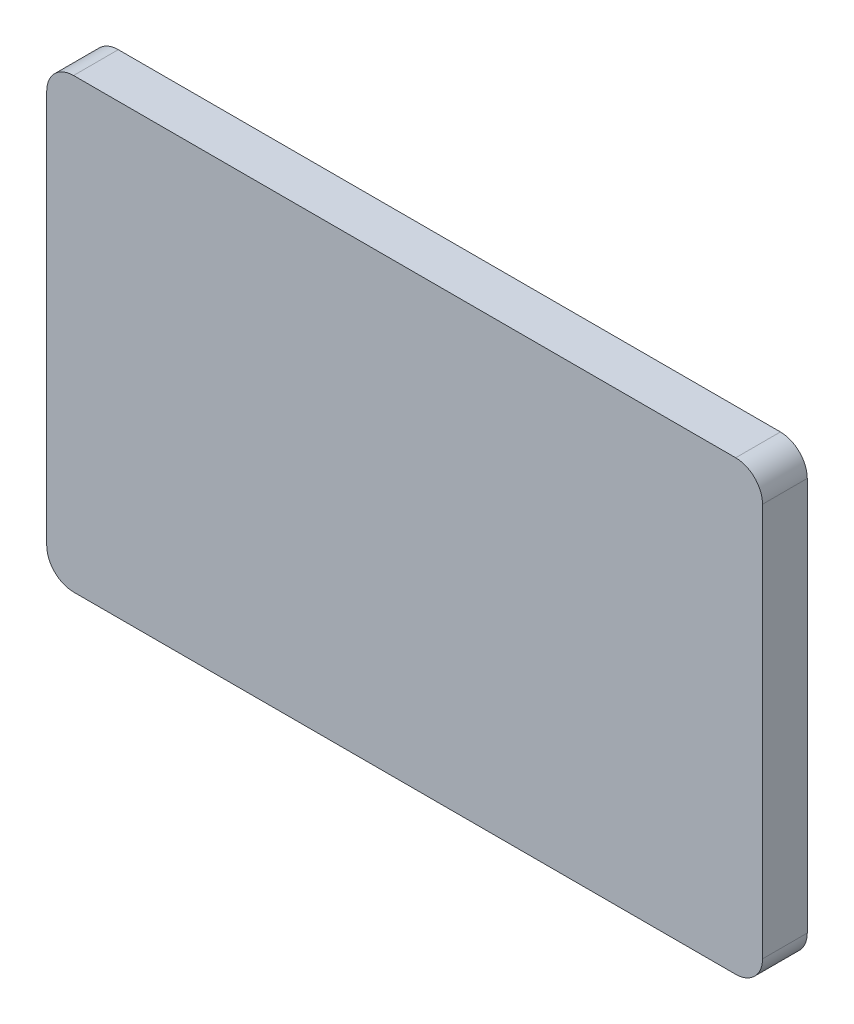
from build123d import *

# Parameters (mm, degrees)
SKETCH1_W           = 80
SKETCH1_H           = 50
BOSS_EXTRUDE1_DEPTH = 5
FILLET1_R           = 3


with BuildPart() as part:
    # Sketch1 → Boss-Extrude1 (new body)
    with BuildSketch(Plane.XY):
        Rectangle(SKETCH1_W, SKETCH1_H)
    extrude(amount=BOSS_EXTRUDE1_DEPTH)

    # Fillet1
    fillet1_edges = [part.edges().sort_by_distance(p)[0] for p in [
        (40, -25, 2.5),
        (-40, -25, 2.5),
        (-40, 25, 2.5),
        (40, 25, 2.5),
    ]]
    fillet(fillet1_edges, radius=FILLET1_R)


solid = part.part
